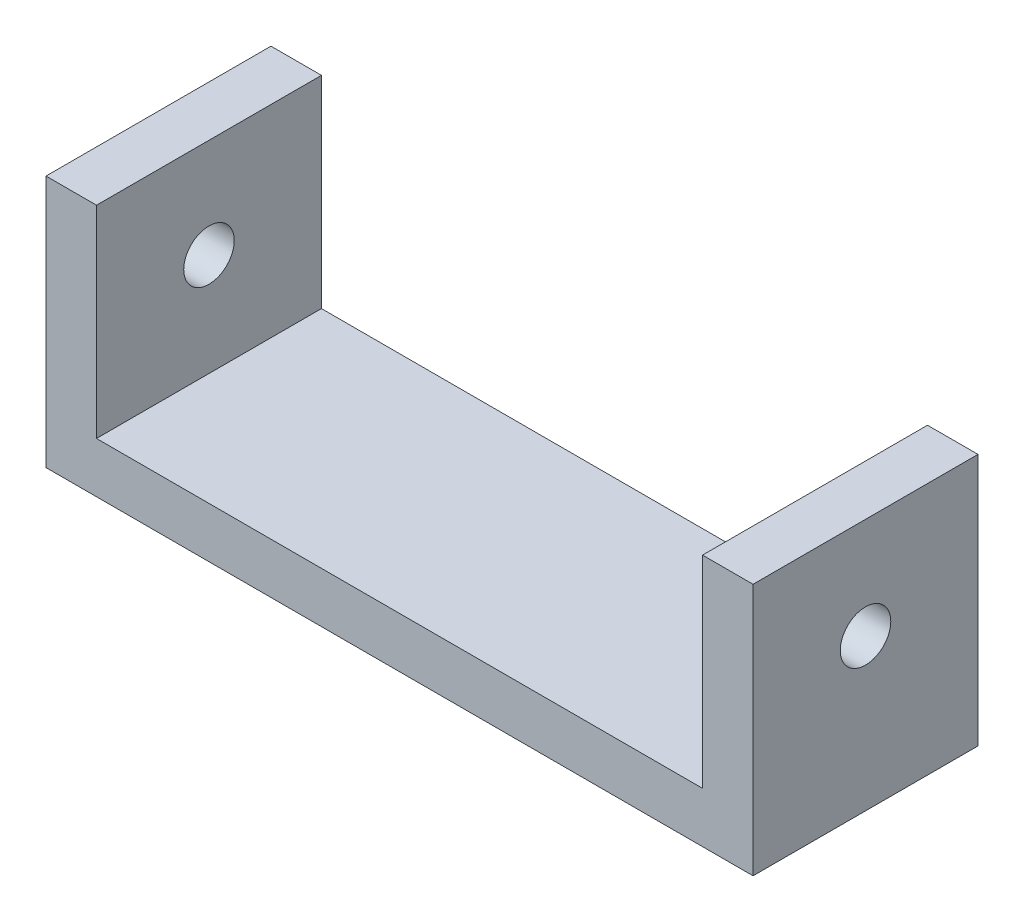
from build123d import *

# Parameters (mm, degrees)
SKETCH1_W           = 88.9
SKETCH1_H           = 28.284249084
BOSS_EXTRUDE1_DEPTH = 6.35
SKETCH2_W           = 6.35
SKETCH2_H           = 28.284249084
BOSS_EXTRUDE2_DEPTH = 25.4
SKETCH3_R           = 3.175
CUT_EXTRUDE1_DEPTH  = 6.35
SKETCH4_R           = 3.175
CUT_EXTRUDE2_DEPTH  = 7.62


with BuildPart() as part:
    # Sketch1 → Boss-Extrude1 (new body)
    with BuildSketch(Plane(origin=(0, 0, 0), x_dir=(1, 0, 0), z_dir=(0, 1, 0))):
        Rectangle(SKETCH1_W, SKETCH1_H)
    extrude(amount=BOSS_EXTRUDE1_DEPTH)

    # Sketch2 → Boss-Extrude2 (add)
    with BuildSketch(Plane(origin=(0, 6.35, 0), x_dir=(1, 0, 0), z_dir=(0, 1, 0))):
        with Locations((-41.275, 0)):
            Rectangle(SKETCH2_W, SKETCH2_H)
        with Locations((41.275, 0)):
            Rectangle(SKETCH2_W, SKETCH2_H)
    extrude(amount=BOSS_EXTRUDE2_DEPTH)

    # Sketch3 → Cut-Extrude1 (cut)
    with BuildSketch(Plane.ZY.offset(44.45)):
        with Locations((0, 19.247915812)):
            Circle(SKETCH3_R)
    extrude(amount=-CUT_EXTRUDE1_DEPTH, mode=Mode.SUBTRACT)

    # Sketch4 → Cut-Extrude2 (cut)
    with BuildSketch(Plane(origin=(44.45, 0, 0), x_dir=(0, 0, -1), z_dir=(1, 0, 0))):
        with Locations((0, 19.05)):
            Circle(SKETCH4_R)
    extrude(amount=-CUT_EXTRUDE2_DEPTH, mode=Mode.SUBTRACT)


solid = part.part
